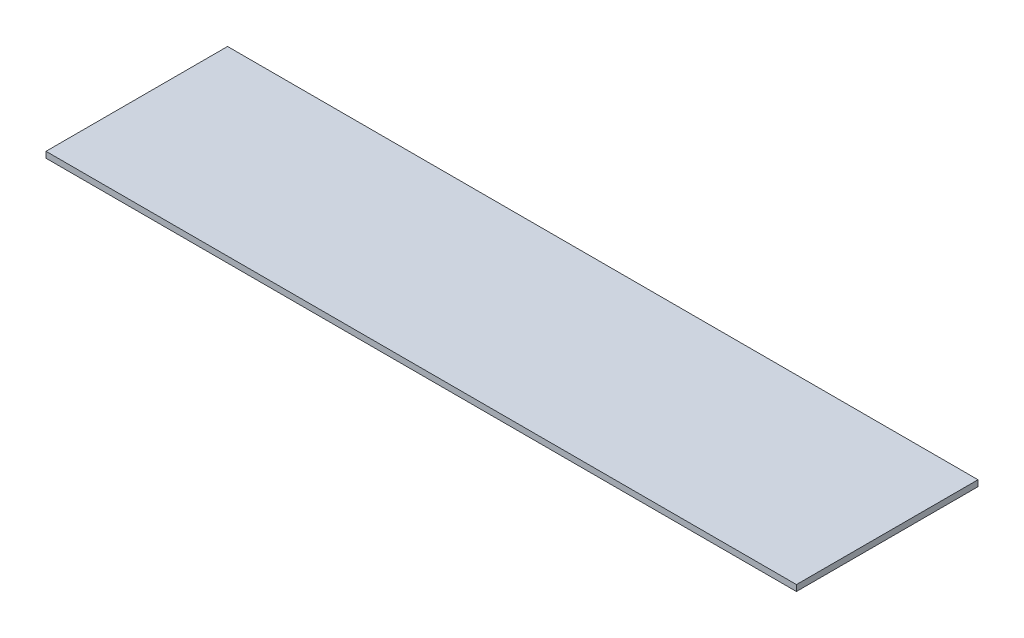
from build123d import *

# Parameters (mm, degrees)
SKETCH1_W           = 787.4
SKETCH1_H           = 190.5
BOSS_EXTRUDE1_DEPTH = 6.35


with BuildPart() as part:
    # Sketch1 → Boss-Extrude1 (new body)
    with BuildSketch(Plane(origin=(0, 0, 0), x_dir=(1, 0, 0), z_dir=(0, 1, 0))):
        Rectangle(SKETCH1_W, SKETCH1_H)
    extrude(amount=BOSS_EXTRUDE1_DEPTH)


solid = part.part
